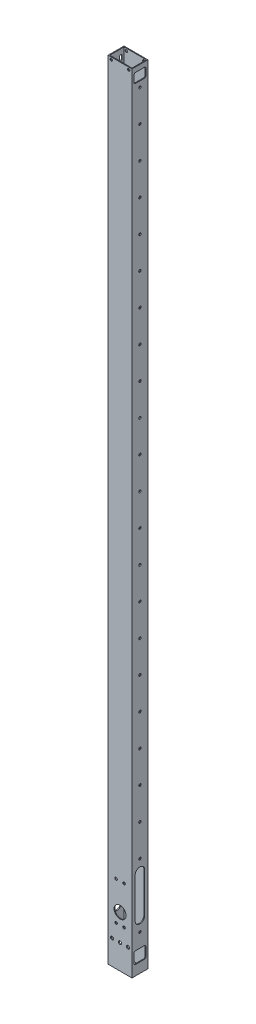
from build123d import *

# Parameters (mm, degrees)
SKETCH_1_W           = 30
SKETCH_1_H           = 20
SKETCH_1_W_2         = 28
SKETCH_1_H_2         = 18
EXTRUDE_1_DEPTH      = 980
CUT_EXTRUDE_3_DEPTH  = 981.51007134
SKETCH_5_W           = 15
SKETCH_5_H           = 12
CUT_EXTRUDE_4_DEPTH  = 10
SKETCH_9_R           = 1.5
CUT_EXTRUDE_7_DEPTH  = 981.318825689
SKETCH_13_W          = 30
SKETCH_13_H          = 20
SKETCH_13_W_2        = 28
SKETCH_13_H_2        = 18
EXTRUDE_2_DEPTH      = 10
CUT_EXTRUDE_8_DEPTH  = 60
SKETCH_15_W          = 15
SKETCH_15_H          = 15
CUT_EXTRUDE_10_DEPTH = 5
FILLET_1_R           = 2
SKETCH_16_R          = 2
CUT_EXTRUDE_11_DEPTH = 90
FILLET_2_R           = 2
SKETCH_17_R          = 1.5
CUT_EXTRUDE_12_DEPTH = 40
CUT_EXTRUDE_15_DEPTH = 51
SKETCH_21_W          = 22.187259215
SKETCH_21_H          = 65.33837704
EXTRUDE_3_DEPTH      = 1
SKETCH_22_R          = 1.65
CUT_EXTRUDE_16_DEPTH = 1
SKETCH_23_R          = 7.5
CUT_EXTRUDE_17_DEPTH = 10


with BuildPart() as part:
    # 草图1 → 凸台-拉伸1 (new body)
    with BuildSketch(Plane(origin=(0, 0, 0), x_dir=(1, 0, 0), z_dir=(0, 1, 0))):
        Rectangle(SKETCH_1_W, SKETCH_1_H)
        Rectangle(SKETCH_1_W_2, SKETCH_1_H_2, mode=Mode.SUBTRACT)
    extrude(amount=EXTRUDE_1_DEPTH)

    # 草图4 → 切除-拉伸3 (cut, through all)
    with BuildSketch(Plane(origin=(15, 0, 0), x_dir=(0, 0, -1), z_dir=(1, 0, 0))):
        with BuildLine():
            Line((3.4, 968), (3.4, 972))
            ThreePointArc((3.4, 972), (5, 973.6), (6.6, 972))
            Line((6.6, 972), (6.6, 968))
            ThreePointArc((6.6, 968), (5, 966.4), (3.4, 968))
        make_face()
        with BuildLine():
            Line((-3.4, 968), (-3.4, 972))
            ThreePointArc((-3.4, 972), (-5, 973.6), (-6.6, 972))
            Line((-6.6, 972), (-6.6, 968))
            ThreePointArc((-6.6, 968), (-5, 966.4), (-3.4, 968))
        make_face()
    extrude(amount=-CUT_EXTRUDE_3_DEPTH, mode=Mode.SUBTRACT)

    # 草图5 → 切除-拉伸4 (cut)
    with BuildSketch(Plane(origin=(15, 0, 0), x_dir=(0, 0, -1), z_dir=(1, 0, 0))):
        with Locations((0, 968)):
            Rectangle(SKETCH_5_W, SKETCH_5_H)
    extrude(amount=-CUT_EXTRUDE_4_DEPTH, mode=Mode.SUBTRACT)

    # 草图9 → 切除-拉伸7 (cut, through all)
    with BuildSketch(Plane.XY.offset(10)):
        with Locations((11, 977)):
            Circle(SKETCH_9_R)
        with Locations((-11, 977)):
            Circle(SKETCH_9_R)
    extrude(amount=-CUT_EXTRUDE_7_DEPTH, mode=Mode.SUBTRACT)

    # 草图13 → 凸台-拉伸2 (add)
    with BuildSketch(Plane.XZ):
        Rectangle(SKETCH_13_W, SKETCH_13_H)
        Rectangle(SKETCH_13_W_2, SKETCH_13_H_2, mode=Mode.SUBTRACT)
    extrude(amount=EXTRUDE_2_DEPTH)

    # 草图11 → 切除-拉伸8 (cut)
    with BuildSketch(Plane(origin=(-14, 0, 0), x_dir=(0, 0, -1), z_dir=(1, 0, 0))):
        with BuildLine():
            Line((-6.6, 5), (-6.6, 15))
            ThreePointArc((-6.6, 15), (-5, 16.6), (-3.4, 15))
            Line((-3.4, 15), (-3.4, 5))
            ThreePointArc((-3.4, 5), (-5, 3.4), (-6.6, 5))
        make_face()
        with BuildLine():
            Line((6.6, 5), (6.6, 15))
            ThreePointArc((6.6, 15), (5, 16.6), (3.4, 15))
            Line((3.4, 15), (3.4, 5))
            ThreePointArc((3.4, 5), (5, 3.4), (6.6, 5))
        make_face()
    extrude(amount=-CUT_EXTRUDE_8_DEPTH, mode=Mode.SUBTRACT)

    # 草图15 → 切除-拉伸10 (cut)
    with BuildSketch(Plane(origin=(15, 0, 0), x_dir=(0, 0, -1), z_dir=(1, 0, 0))):
        with Locations((0, 10)):
            Rectangle(SKETCH_15_W, SKETCH_15_H)
    extrude(amount=-CUT_EXTRUDE_10_DEPTH, mode=Mode.SUBTRACT)

    # 圆角1
    fillet_1_edges = [part.edges().sort_by_distance(p)[0] for p in [
        (14.5, 2.5, -7.5),
        (14.5, 2.5, 7.5),
        (14.5, 17.5, -7.5),
        (14.5, 17.5, 7.5),
    ]]
    fillet(fillet_1_edges, radius=FILLET_1_R)

    # 草图16 → 切除-拉伸11 (cut)
    with BuildSketch(Plane.XY.offset(10)):
        with Locations((10, 21)):
            Circle(SKETCH_16_R)
        with Locations((0, 21)):
            Circle(SKETCH_16_R)
        with Locations((-10, 21)):
            Circle(SKETCH_16_R)
    extrude(amount=-CUT_EXTRUDE_11_DEPTH, mode=Mode.SUBTRACT)

    # 圆角2
    fillet_2_edges = [part.edges().sort_by_distance(p)[0] for p in [
        (14.5, 962, -7.5),
        (14.5, 962, 7.5),
        (14.5, 974, 7.5),
        (14.5, 974, -7.5),
    ]]
    fillet(fillet_2_edges, radius=FILLET_2_R)

    # 草图17 → 切除-拉伸12 (cut)
    with BuildSketch(Plane(origin=(15, 0, 0), x_dir=(0, 0, -1), z_dir=(1, 0, 0))):
        with Locations((0, 955)):
            Circle(SKETCH_17_R)
        with Locations((0, 915)):
            Circle(SKETCH_17_R)
        with Locations((0, 875)):
            Circle(SKETCH_17_R)
        with Locations((0, 835)):
            Circle(SKETCH_17_R)
        with Locations((0, 795)):
            Circle(SKETCH_17_R)
        with Locations((0, 755)):
            Circle(SKETCH_17_R)
        with Locations((0, 715)):
            Circle(SKETCH_17_R)
        with Locations((0, 675)):
            Circle(SKETCH_17_R)
        with Locations((0, 635)):
            Circle(SKETCH_17_R)
        with Locations((0, 595)):
            Circle(SKETCH_17_R)
        with Locations((0, 555)):
            Circle(SKETCH_17_R)
        with Locations((0, 515)):
            Circle(SKETCH_17_R)
        with Locations((0, 475)):
            Circle(SKETCH_17_R)
        with Locations((0, 435)):
            Circle(SKETCH_17_R)
        with Locations((0, 395)):
            Circle(SKETCH_17_R)
        with Locations((0, 355)):
            Circle(SKETCH_17_R)
        with Locations((0, 315)):
            Circle(SKETCH_17_R)
        with Locations((0, 275)):
            Circle(SKETCH_17_R)
        with Locations((0, 235)):
            Circle(SKETCH_17_R)
        with Locations((0, 195)):
            Circle(SKETCH_17_R)
        with Locations((0, 155)):
            Circle(SKETCH_17_R)
        with Locations((0, 115)):
            Circle(SKETCH_17_R)
        with Locations((0, 75)):
            Circle(SKETCH_17_R)
        with Locations((0, 35)):
            Circle(SKETCH_17_R)
    extrude(amount=-CUT_EXTRUDE_12_DEPTH, mode=Mode.SUBTRACT)

    # 草图20 → 切除-拉伸15 (cut)
    with BuildSketch(Plane(origin=(15, 0, 0), x_dir=(0, 0, -1), z_dir=(1, 0, 0))):
        with BuildLine():
            Line((-6, 50), (-6, 100))
            ThreePointArc((-6, 100), (0, 106), (6, 100))
            Line((6, 100), (6, 50))
            ThreePointArc((6, 50), (0, 44), (-6, 50))
        make_face()
    extrude(amount=-CUT_EXTRUDE_15_DEPTH, mode=Mode.SUBTRACT)

    # 草图21 → 凸台-拉伸3 (add)
    with BuildSketch(Plane.XY.offset(10)):
        with Locations((-0.689634309, 76.201822832)):
            Rectangle(SKETCH_21_W, SKETCH_21_H)
    extrude(amount=-EXTRUDE_3_DEPTH)

    # 草图22 → 切除-拉伸16 (cut)
    with BuildSketch(Plane.XY.offset(10)):
        with Locations((5, 40)):
            Circle(SKETCH_22_R)
        with Locations((-5, 40)):
            Circle(SKETCH_22_R)
        with Locations((5, 88)):
            Circle(SKETCH_22_R)
        with Locations((-5, 88)):
            Circle(SKETCH_22_R)
    extrude(amount=-CUT_EXTRUDE_16_DEPTH, mode=Mode.SUBTRACT)

    # 草图23 → 切除-拉伸17 (cut)
    with BuildSketch(Plane.XY.offset(10)):
        with Locations((0, 54.25)):
            Circle(SKETCH_23_R)
    extrude(amount=-CUT_EXTRUDE_17_DEPTH, mode=Mode.SUBTRACT)


solid = part.part
